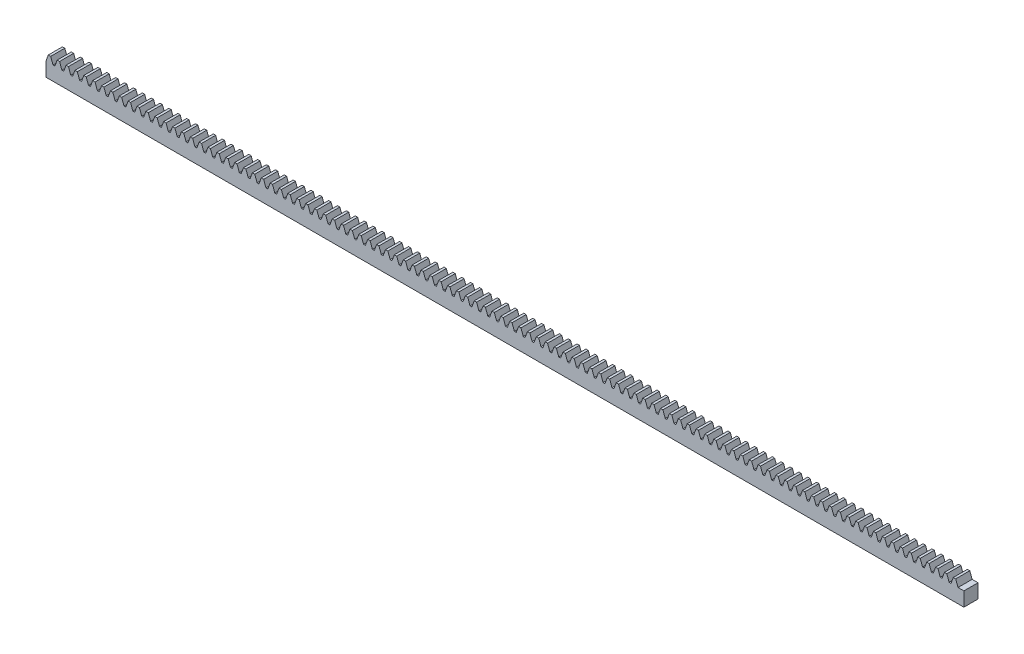
from build123d import *

# Parameters (mm, degrees)
SKETCH_1_W             = 650
SKETCH_1_H             = 10
EXTRUDE_1_DEPTH        = 10
EXTRUDE_2_DEPTH        = 10
PATTERN_LINEAR_1_COUNT = 103
PATTERN_LINEAR_1_PITCH = 6.283185307


with BuildPart() as part:
    # 草图1 → 拉伸1 (new body)
    with BuildSketch(Plane.XY):
        with Locations((325, -5)):
            Rectangle(SKETCH_1_W, SKETCH_1_H)
    extrude(amount=EXTRUDE_1_DEPTH)

    # 草图2 → 拉伸2 (add)
    with BuildSketch(Plane.XY.offset(10)):
        Polygon((0, 0), (1.637866054, 4.5), (3.323577771, 4.5), (4.961443825, 0), align=None)
    extrude_2 = extrude(amount=-EXTRUDE_2_DEPTH)

    # 阵列(线性)1: 拉伸2 ×103
    with Locations(*[(i * PATTERN_LINEAR_1_PITCH, 0, 0) for i in range(1, PATTERN_LINEAR_1_COUNT)]):
        add(extrude_2)


solid = part.part
